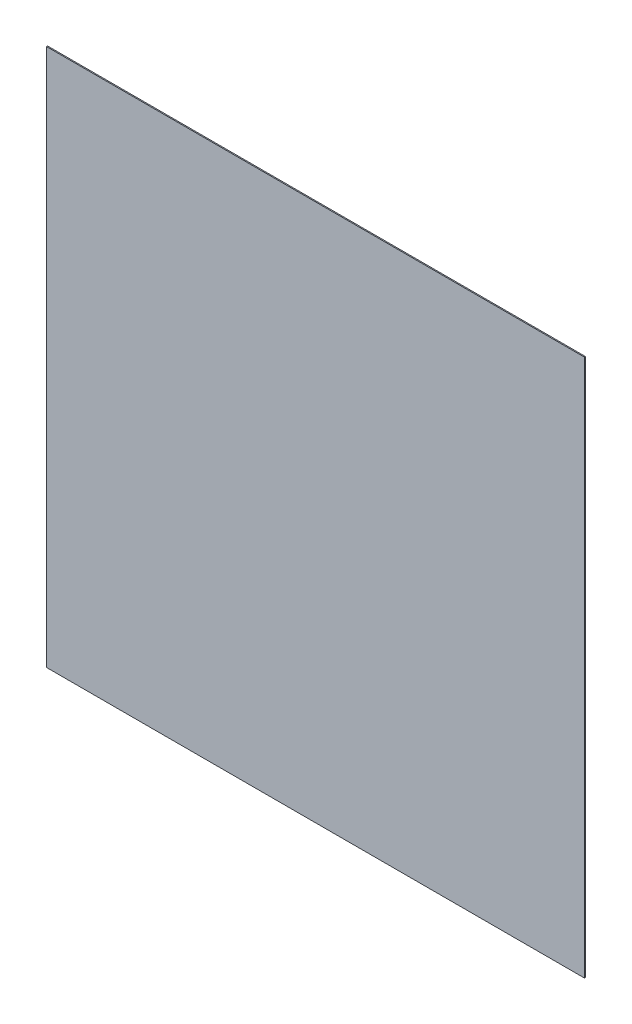
from build123d import *

# Parameters (mm, degrees)
SKETCH1_W           = 2504
SKETCH1_H           = 2504
BOSS_EXTRUDE1_DEPTH = 5


with BuildPart() as part:
    # Sketch1 → Boss-Extrude1 (new body)
    with BuildSketch(Plane.XY):
        Rectangle(SKETCH1_W, SKETCH1_H)
    extrude(amount=BOSS_EXTRUDE1_DEPTH)


solid = part.part
